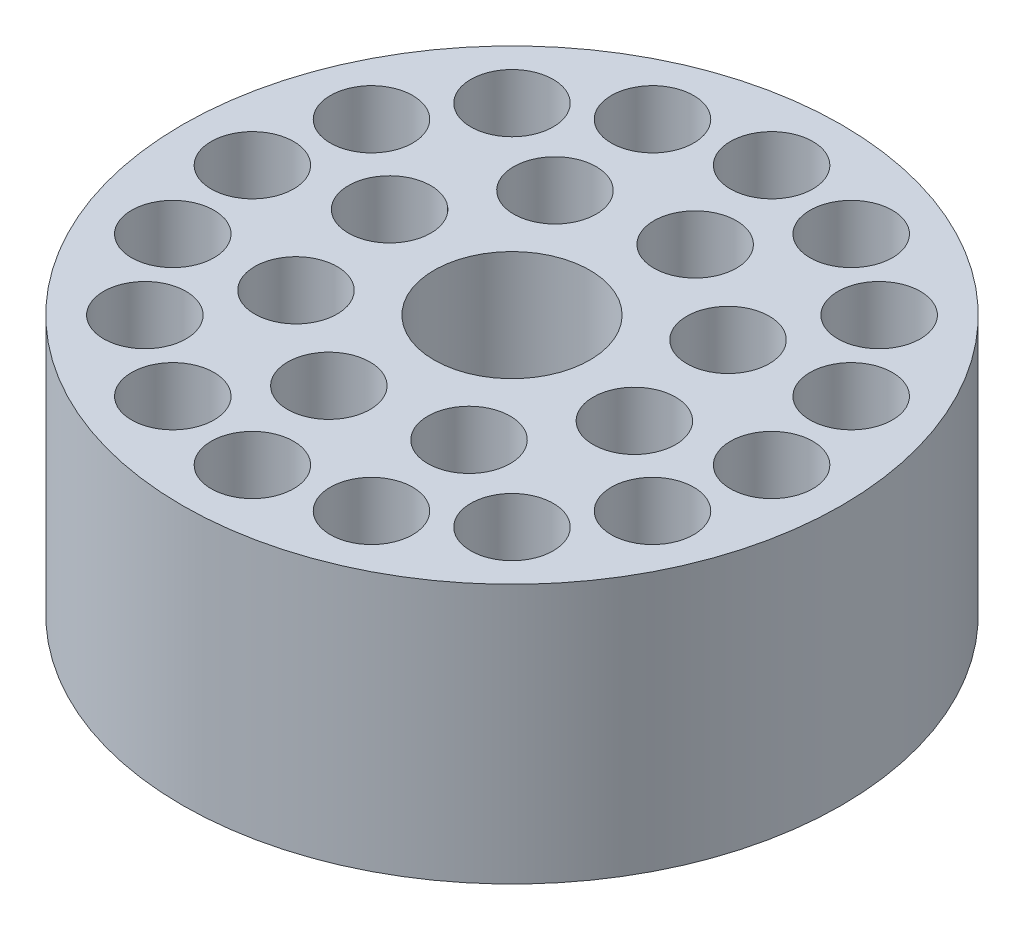
from build123d import *

# Parameters (mm, degrees)
SKETCH1_R           = 6.35
BOSS_EXTRUDE1_DEPTH = 5
SKETCH2_R           = 0.79375
CUT_EXTRUDE1_DEPTH  = 11.278375358
CIRPATTERN1_COUNT   = 16
SKETCH3_R           = 0.79375
CUT_EXTRUDE2_DEPTH  = 11.278375358
CIRPATTERN3_COUNT   = 8
SKETCH4_R           = 1.5
CUT_EXTRUDE3_DEPTH  = 11.278375358


with BuildPart() as part:
    # Sketch1 → Boss-Extrude1 (new body)
    with BuildSketch(Plane(origin=(0, 0, 0), x_dir=(1, 0, 0), z_dir=(0, 1, 0))):
        with Locations(Location((0, 0, 0), (0, 0, 270))):
            Circle(SKETCH1_R)
    extrude(amount=BOSS_EXTRUDE1_DEPTH)

    # Sketch2 → Cut-Extrude1 (cut, through all)
    with BuildSketch(Plane(origin=(0, 5, 0), x_dir=(1, 0, 0), z_dir=(0, 1, 0))):
        with Locations(Location((0, 5, 0), (0, 0, 270))):
            Circle(SKETCH2_R)
    cut_extrude1 = extrude(amount=-CUT_EXTRUDE1_DEPTH, mode=Mode.SUBTRACT)

    # CirPattern1: Cut-Extrude1 ×16 about axis
    cirpattern1_axis = Axis((0, 0, 0), (0, 1, 0))
    for i in range(1, CIRPATTERN1_COUNT):
        add(cut_extrude1.rotate(cirpattern1_axis, i * 360 / CIRPATTERN1_COUNT), mode=Mode.SUBTRACT)

    # Sketch3 → Cut-Extrude2 (cut, through all)
    with BuildSketch(Plane(origin=(0, 5, 0), x_dir=(1, 0, 0), z_dir=(0, 1, 0))):
        with Locations(Location((0.585270966, 2.942355841, 0), (0, 0, 270))):
            Circle(SKETCH3_R)
    cut_extrude2 = extrude(amount=-CUT_EXTRUDE2_DEPTH, mode=Mode.SUBTRACT)

    # CirPattern3: Cut-Extrude2 ×8 about axis
    cirpattern3_axis = Axis((0, 0, 0), (0, 1, 0))
    for i in range(1, CIRPATTERN3_COUNT):
        add(cut_extrude2.rotate(cirpattern3_axis, i * 360 / CIRPATTERN3_COUNT), mode=Mode.SUBTRACT)

    # Sketch4 → Cut-Extrude3 (cut, through all)
    with BuildSketch(Plane(origin=(0, 5, 0), x_dir=(1, 0, 0), z_dir=(0, 1, 0))):
        with Locations(Location((0, 0, 0), (0, 0, 270))):
            Circle(SKETCH4_R)
    extrude(amount=-CUT_EXTRUDE3_DEPTH, mode=Mode.SUBTRACT)


solid = part.part
